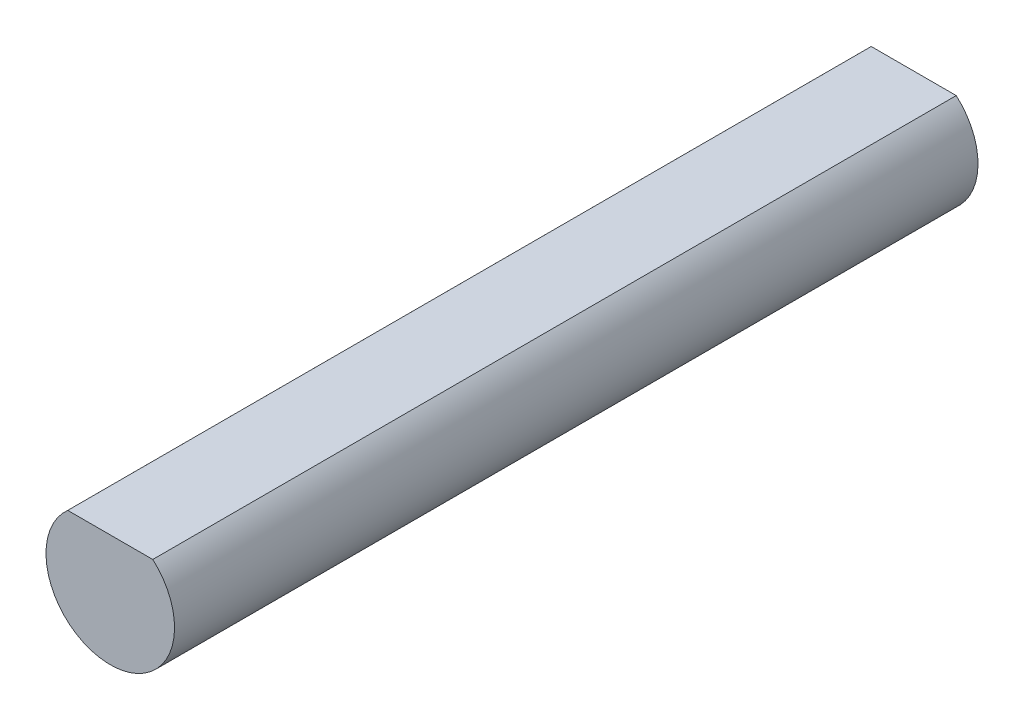
from build123d import *

# Parameters (mm, degrees)
BOSS_EXTRUDE1_DEPTH = 25


with BuildPart() as part:
    # Sketch2 → Boss-Extrude1 (new body)
    with BuildSketch(Plane.XY):
        with BuildLine():
            Line((-1.322875656, 1.5), (1.322875656, 1.5))
            ThreePointArc((1.322875656, 1.5), (0, -2), (-1.322875656, 1.5))
        make_face()
    extrude(amount=BOSS_EXTRUDE1_DEPTH)


solid = part.part
